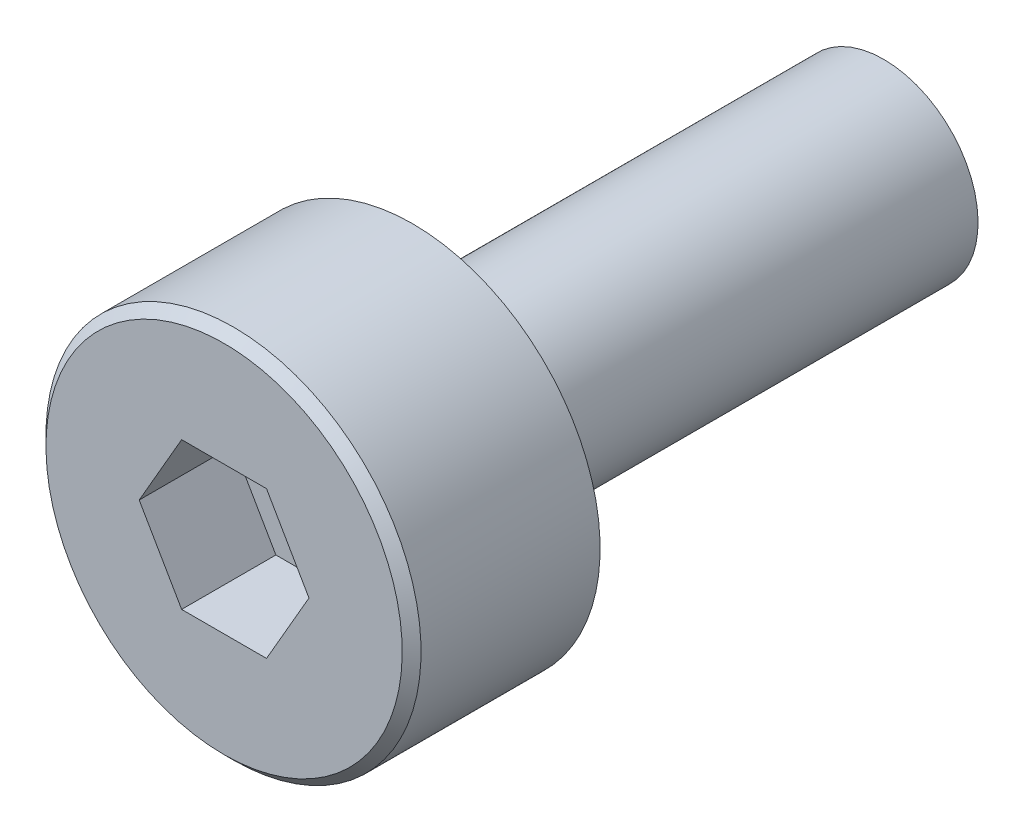
from build123d import *

# Parameters (mm, degrees)
CUT_EXTRUDE_1_DEPTH = 1
CHAMFER_623_SIZE    = 0.1


with BuildPart() as part:
    # 草图1 → 旋转1 (revolve)
    with BuildSketch(Plane(origin=(0, 0, 0), x_dir=(0, 0, -1), z_dir=(1, 0, 0))):
        Polygon((0, 0), (0, 1.99), (2, 1.99), (2, 1), (7, 1), (7, 0), align=None)
    revolve(axis=Axis((0, 0, -7), (0, 0, 1)))

    # 草图2 → 切除-拉伸1 (cut)
    with BuildSketch(Plane.XY):
        Polygon((0.45033321, 0.78), (-0.45033321, 0.78), (-0.90066642, 0), (-0.45033321, -0.78), (0.45033321, -0.78), (0.90066642, 0), align=None)
    extrude(amount=-CUT_EXTRUDE_1_DEPTH, mode=Mode.SUBTRACT)

    # Chamfer 623
    chamfer_623_edges = [part.edges().sort_by_distance(p)[0] for p in [
        (0, -1.99, 0),
    ]]
    chamfer(chamfer_623_edges, length=CHAMFER_623_SIZE)


solid = part.part
